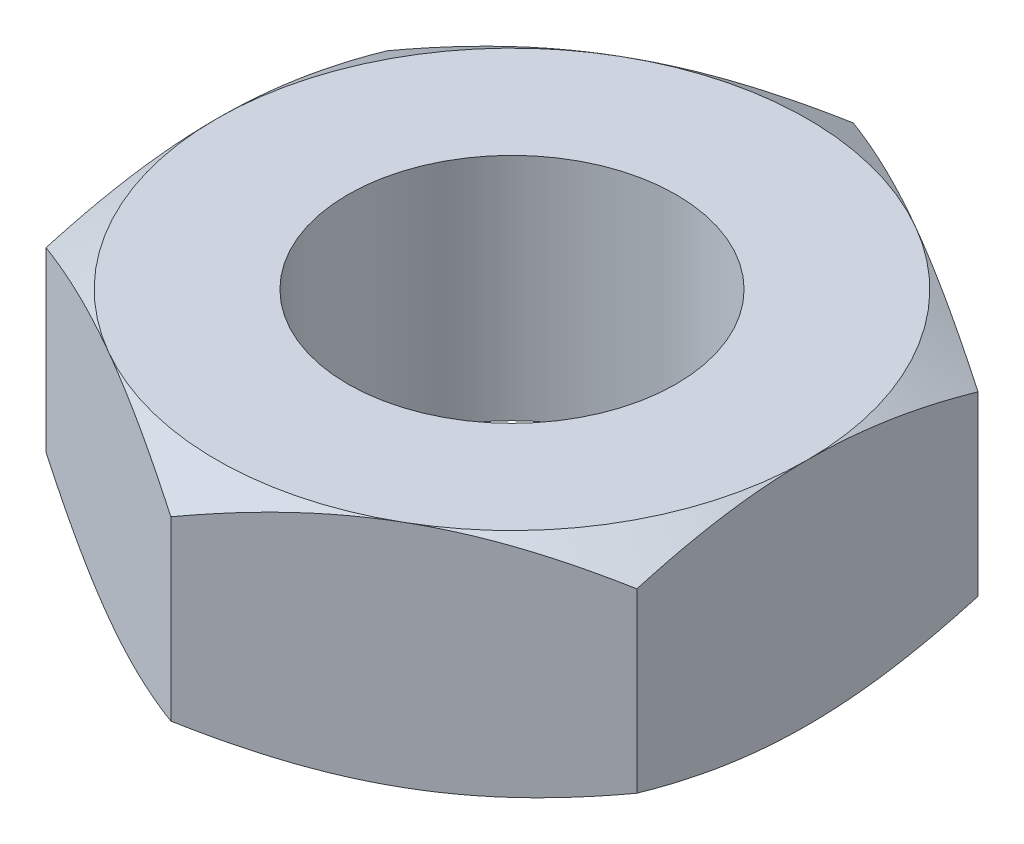
from build123d import *

# Parameters (mm, degrees)
SKETCH1_R               = 1.25
BOSS_EXTRUDE1_DEPTH     = 1.75
SKETCH2_OUTSIDE_W       = 14.846
SKETCH2_OUTSIDE_H       = 15.542
SKETCH2_OUTSIDE_R       = 2.25
CUT_EXTRUDE1_DEPTH      = 2
CUT_EXTRUDE1_DRAFT      = -60
MIRROR1_COPY_1_SKETCH_W = 14.846
MIRROR1_COPY_1_SKETCH_H = 15.542
MIRROR1_COPY_1_SKETCH_R = 2.25
MIRROR1_COPY_1_DEPTH    = 2
MIRROR1_COPY_1_DRAFT    = -60


with BuildPart() as part:
    # Sketch1 → Boss-Extrude1 (new body)
    with BuildSketch(Plane(origin=(0, 0, 0), x_dir=(1, 0, 0), z_dir=(0, 1, 0))):
        Polygon((0, 2.598076211), (-2.25, 1.299038106), (-2.25, -1.299038106), (0, -2.598076211), (2.25, -1.299038106), (2.25, 1.299038106), align=None)
        with Locations(Location((0, 0, 0), (0, 0, 270))):
            Circle(SKETCH1_R, mode=Mode.SUBTRACT)
    extrude(amount=BOSS_EXTRUDE1_DEPTH)


with BuildPart() as cut_extrude1_tool:
    # Sketch2 outside → Cut-Extrude1 (with draft: the straight prism first)
    with BuildSketch(Plane(origin=(0, 1.75, 0), x_dir=(1, 0, 0), z_dir=(0, 1, 0))):
        Rectangle(SKETCH2_OUTSIDE_W, SKETCH2_OUTSIDE_H)
        Circle(SKETCH2_OUTSIDE_R, mode=Mode.SUBTRACT)
    extrude(amount=-CUT_EXTRUDE1_DEPTH)
    # Cut-Extrude1: the draft: its side faces are tilted about the plane it starts from
    cut_extrude1_sides = [cut_extrude1_tool.faces().sort_by_distance(p)[0] for p in [
        (0, 0.75, 7.771),
        (7.423, 0.75, 0),
        (0, 0.75, -7.771),
        (-7.423, 0.75, 0),
        (-2.25, 0.75, 0),
    ]]
    draft(cut_extrude1_sides, Plane(origin=(0, 1.75, 0), x_dir=(1, 0, 0), z_dir=(0, 1, 0)), CUT_EXTRUDE1_DRAFT)


with BuildPart() as part_1:
    add(part.part)

    # Cut-Extrude1: cut by cut_extrude1_tool
    add(cut_extrude1_tool.part, mode=Mode.SUBTRACT)


with BuildPart() as mirror1_copy_1_tool:
    # Mirror1 copy 1 sketch → Mirror1 copy 1 (with draft: the straight prism first)
    with BuildSketch(Plane.XZ):
        Rectangle(MIRROR1_COPY_1_SKETCH_W, MIRROR1_COPY_1_SKETCH_H)
        Circle(MIRROR1_COPY_1_SKETCH_R, mode=Mode.SUBTRACT)
    extrude(amount=-MIRROR1_COPY_1_DEPTH)
    # Mirror1 copy 1: the draft: its side faces are tilted about the plane it starts from
    mirror1_copy_1_sides = [mirror1_copy_1_tool.faces().sort_by_distance(p)[0] for p in [
        (0, 1, 7.771),
        (7.423, 1, 0),
        (0, 1, -7.771),
        (-7.423, 1, 0),
        (-2.25, 1, 0),
    ]]
    draft(mirror1_copy_1_sides, Plane.XZ, MIRROR1_COPY_1_DRAFT)


with BuildPart() as part_2:
    add(part_1.part)

    # Mirror1 copy 1: cut by mirror1_copy_1_tool
    add(mirror1_copy_1_tool.part, mode=Mode.SUBTRACT)


solid = part_2.part
